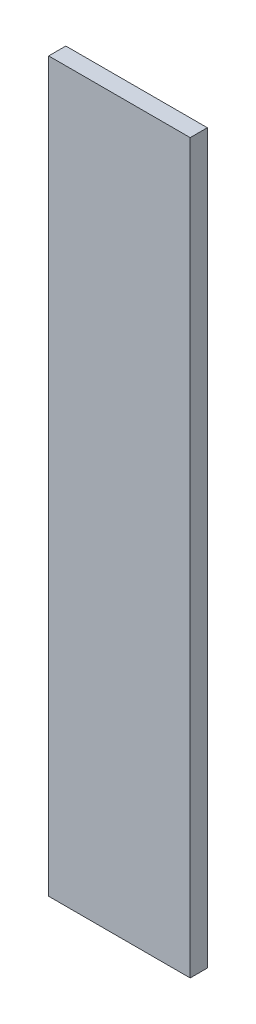
from build123d import *

# Parameters (mm, degrees)
SKETCH1_W           = 22.225
SKETCH1_H           = 114.3
BOSS_EXTRUDE1_DEPTH = 2.6924


with BuildPart() as part:
    # Sketch1 → Boss-Extrude1 (new body)
    with BuildSketch(Plane.XY):
        with Locations((-40.492238058, 24.814983151)):
            Rectangle(SKETCH1_W, SKETCH1_H)
    extrude(amount=BOSS_EXTRUDE1_DEPTH)


solid = part.part
